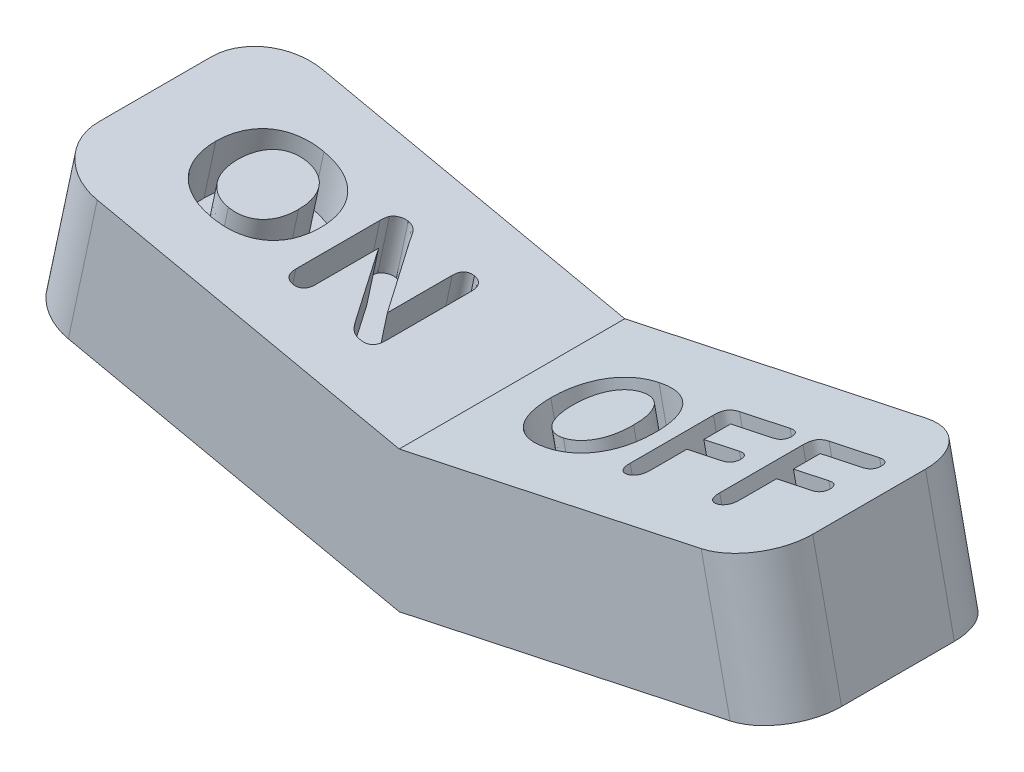
from build123d import *

# Parameters (mm, degrees)
AUFSATZ_LINEAR_AUSTRAGEN2_DEPTH = 4
SCHNITT_LINEAR_AUSTRAGEN1_DEPTH = 1
SCHNITT_LINEAR_AUSTRAGEN2_DEPTH = 1
VERRUNDUNG1_R                   = 1


with BuildPart() as part:
    # Skizze1 → Aufsatz-Linear austragen2 (new body)
    with BuildSketch(Plane.XY):
        Polygon((0.667578223, 3.856947524), (7, 2.5), (13.332421777, 3.856947524), (13.844616899, 1.466703621), (7, 0), (0.155383101, 1.466703621), align=None)
    extrude(amount=AUFSATZ_LINEAR_AUSTRAGEN2_DEPTH)

    # Skizze2 → Schnitt-Linear austragen1 (cut)
    # profile 1 of 2: a face of its own
    with BuildSketch(Plane(origin=(0.819512195, 3.824390244, 0), x_dir=(0.9778024140774095, -0.2095290887308736, 0), z_dir=(0.2095290887308736, 0.9778024140774095, 0))):
        with BuildLine():
            add(Edge.make_bspline(
                [(1.912976274, -1.025), (1.937729293, -1.025347484), (1.986265259, -1.026028833), (2.057705691, -1.03220508), (2.126606575, -1.04137252), (2.192921264, -1.054568029), (2.256485248, -1.071786253), (2.317310632, -1.09294775), (2.375475794, -1.117982427), (2.431048762, -1.146399113), (2.483419062, -1.178566708), (2.532920134, -1.213743636), (2.578991288, -1.252445964), (2.621739919, -1.294333963), (2.660893281, -1.339521926), (2.697020585, -1.387758951), (2.729843534, -1.43931638), (2.759008617, -1.494183256), (2.785211472, -1.55153976), (2.807957304, -1.611553994), (2.826941877, -1.673971707), (2.842732947, -1.73889629), (2.85470098, -1.806232722), (2.863131075, -1.876138703), (2.868967255, -1.948338503), (2.869398247, -1.997383913), (2.869616899, -2.022265625)],
                knots=[0, 0, 0, 0, 1.137132438, 2.22970057, 3.292424762, 4.329649132, 5.333981859, 6.315987487, 7.286185149, 8.241436353, 9.181332131, 10.107725602, 11.0292572, 11.943085262, 12.854854597, 13.773819033, 14.709898734, 15.660115542, 16.626635295, 17.605574315, 18.606712189, 19.622473761, 20.67399022, 21.747038223, 22.857027702, 24, 24, 24, 24], degree=3))
            add(Edge.make_bspline(
                [(2.869616899, -2.022265625), (2.868853842, -2.058751656), (2.867356635, -2.130341511), (2.85599984, -2.23514776), (2.836747841, -2.33491422), (2.810528051, -2.429600419), (2.776065586, -2.518550839), (2.734138271, -2.601648664), (2.684333621, -2.678492791), (2.627188206, -2.749013755), (2.562920535, -2.81281208), (2.491091537, -2.86842953), (2.412146644, -2.915899136), (2.326787109, -2.955883731), (2.234501668, -2.987386962), (2.135477181, -3.008566743), (2.030325273, -3.022981952), (1.957949638, -3.024315366), (1.920788774, -3.025)],
                knots=[0, 0, 0, 0, 1.119700056, 2.196982321, 3.230778928, 4.235358115, 5.208318876, 6.153781848, 7.087131445, 8.013361148, 8.934611457, 9.860297843, 10.794468433, 11.756326826, 12.748403726, 13.780058436, 14.860183413, 16, 16, 16, 16], degree=3))
            add(Edge.make_bspline(
                [(1.920788774, -3.025), (1.883895649, -3.024111768), (1.811670663, -3.022372892), (1.706383768, -3.008438854), (1.606832189, -2.986023965), (1.513584315, -2.95397486), (1.427291494, -2.91316174), (1.3475919, -2.865655446), (1.2760318, -2.809535138), (1.211692016, -2.746402733), (1.154577677, -2.676158659), (1.106021527, -2.598454758), (1.063198965, -2.514982226), (1.029350603, -2.424502932), (1.002420616, -2.328979796), (0.983440858, -2.229124849), (0.971868588, -2.125534077), (0.970375387, -2.055238614), (0.969616899, -2.01953125)],
                knots=[0, 0, 0, 0, 1.130091603, 2.212359386, 3.247930852, 4.252250901, 5.226719473, 6.16821431, 7.089197795, 8.00610207, 8.925165125, 9.855999165, 10.808795857, 11.79501972, 12.810514548, 13.846493258, 14.906102224, 16, 16, 16, 16], degree=3))
            add(Edge.make_bspline(
                [(0.969616899, -2.01953125), (0.970304926, -1.983167117), (0.971657834, -1.911662221), (0.984148642, -1.806900375), (1.003869909, -1.706602276), (1.031979339, -1.611272855), (1.06761968, -1.521581806), (1.110879562, -1.438507263), (1.160965417, -1.362306726), (1.21820868, -1.29312522), (1.282700256, -1.231383937), (1.354079344, -1.17738825), (1.431994591, -1.13094052), (1.516449577, -1.092736526), (1.607060062, -1.062072781), (1.703802482, -1.040423252), (1.806494954, -1.02730765), (1.876868571, -1.025782522), (1.912976274, -1.025)],
                knots=[0, 0, 0, 0, 1.125218611, 2.212582392, 3.260701818, 4.286054269, 5.284468473, 6.243521648, 7.180287843, 8.101949555, 9.017004541, 9.937572836, 10.866572707, 11.818894766, 12.801573564, 13.82236102, 14.882684417, 16, 16, 16, 16], degree=3))
        make_face()
        with BuildLine():
            add(Edge.make_bspline(
                [(2.469616899, -2.01953125), (2.468853014, -1.984722528), (2.467373957, -1.917324774), (2.454265409, -1.819828962), (2.433033611, -1.72939679), (2.407727956, -1.659374991), (2.383428267, -1.607471532), (2.363582759, -1.57134657), (2.342234834, -1.537336639), (2.31800541, -1.506574824), (2.292872072, -1.477593683), (2.265660747, -1.45107662), (2.236324033, -1.427418465), (2.19521348, -1.398703317), (2.139851328, -1.368949379), (2.068370022, -1.343453373), (1.99217361, -1.327741724), (1.939745088, -1.325926707), (1.912976274, -1.325)],
                knots=[0, 0, 0, 0, 1.663767962, 3.22144036, 4.693807908, 6.09809827, 6.772124886, 7.43249818, 8.068074837, 8.689496673, 9.30272399, 9.901527182, 10.503429657, 11.102750509, 12.297797107, 13.495176895, 14.721094103, 16, 16, 16, 16], degree=3))
            add(Edge.make_bspline(
                [(1.912976274, -1.325), (1.893801388, -1.325476979), (1.855904057, -1.326419684), (1.800272141, -1.335372453), (1.746832427, -1.349373624), (1.695833545, -1.368956527), (1.647729683, -1.393964897), (1.602736036, -1.424326737), (1.561395163, -1.459923848), (1.523475662, -1.500612084), (1.489204138, -1.546801438), (1.458798916, -1.598971034), (1.432306915, -1.657121574), (1.409721467, -1.720734194), (1.391858588, -1.789481786), (1.379157176, -1.862643567), (1.371178167, -1.939798117), (1.370145062, -1.992558261), (1.369616899, -2.01953125)],
                knots=[0, 0, 0, 0, 0.926902171, 1.831933723, 2.71800685, 3.595261319, 4.468550136, 5.334998465, 6.214894287, 7.1017058, 8.020008637, 8.99111482, 10.01694856, 11.106630737, 12.25237115, 13.448355624, 14.695502513, 16, 16, 16, 16], degree=3))
            add(Edge.make_bspline(
                [(1.369616899, -2.01953125), (1.37014652, -2.046764167), (1.371182677, -2.100043013), (1.3791454, -2.177980504), (1.391929725, -2.25203045), (1.409665044, -2.321886375), (1.432609519, -2.386733879), (1.460153093, -2.445978766), (1.49103067, -2.500043622), (1.527457171, -2.547420938), (1.566803876, -2.589229111), (1.609089968, -2.625643756), (1.654010316, -2.656665197), (1.701995078, -2.681919634), (1.752781192, -2.700868342), (1.805807248, -2.715229016), (1.861417487, -2.723431427), (1.899278599, -2.724472817), (1.918445024, -2.725)],
                knots=[0, 0, 0, 0, 1.300369924, 2.54406124, 3.737115199, 4.88637188, 5.981883645, 7.016846829, 8.003376514, 8.948590554, 9.863559023, 10.741055788, 11.608647785, 12.46534091, 13.323432129, 14.192248925, 15.0848625, 16, 16, 16, 16], degree=3))
            add(Edge.make_bspline(
                [(1.918445024, -2.725), (1.943130947, -2.724173196), (1.991770596, -2.722544111), (2.062991903, -2.707333439), (2.131038983, -2.683418186), (2.184917516, -2.65588187), (2.225524432, -2.628756898), (2.25486843, -2.605872755), (2.28214803, -2.579831695), (2.308150463, -2.551638957), (2.332245126, -2.520679799), (2.355057842, -2.48734684), (2.376120258, -2.45128373), (2.395606652, -2.412692096), (2.413204211, -2.371642144), (2.428553352, -2.32824289), (2.440789374, -2.282303546), (2.451468641, -2.234250749), (2.459592873, -2.183768426), (2.465370001, -2.131098381), (2.468989745, -2.076092443), (2.469404603, -2.038677613), (2.469616899, -2.01953125)],
                knots=[0, 0, 0, 0, 1.468568495, 2.893578421, 4.316075305, 5.755382189, 6.482330971, 7.222315454, 7.968369796, 8.725783183, 9.504530818, 10.302500265, 11.129737207, 11.9897977, 12.875655565, 13.787998707, 14.728608307, 15.705132475, 16.718642732, 17.771954593, 18.859838044, 20, 20, 20, 20], degree=3))
        make_face(mode=Mode.SUBTRACT)
    # profile 2 of 2: a face of its own
    with BuildSketch(Plane(origin=(0.819512195, 3.824390244, 0), x_dir=(0.9778024140774095, -0.2095290887308736, 0), z_dir=(0.2095290887308736, 0.9778024140774095, 0))):
        with BuildLine():
            Line((3.709460649, -1.259765625), (4.469616899, -2.4))
            Line((4.469616899, -2.4), (4.469616899, -1.24921875))
            add(Edge.make_bspline(
                [(4.469616899, -1.24921875), (4.470203734, -1.231604073), (4.471302903, -1.198610998), (4.479653301, -1.152351591), (4.494284966, -1.113110608), (4.51501909, -1.080885872), (4.540797884, -1.055681931), (4.571235921, -1.037776803), (4.60573453, -1.026803989), (4.630080749, -1.025614679), (4.642663774, -1.025)],
                knots=[0, 0, 0, 0, 1.319117216, 2.470765316, 3.505116792, 4.43580569, 5.318756254, 6.18027265, 7.059497782, 8, 8, 8, 8], degree=3))
            add(Edge.make_bspline(
                [(4.642663774, -1.025), (4.655629651, -1.025626222), (4.680726276, -1.02683833), (4.716217537, -1.037587787), (4.747237022, -1.055678759), (4.773423753, -1.080848886), (4.794535839, -1.113074728), (4.809681281, -1.152267739), (4.817897562, -1.19862235), (4.819018461, -1.231608024), (4.819616899, -1.24921875)],
                knots=[0, 0, 0, 0, 0.959871134, 1.857917088, 2.719075999, 3.600089629, 4.526699118, 5.554128738, 6.694173474, 8, 8, 8, 8], degree=3))
            Line((4.819616899, -1.24921875), (4.819616899, -2.7703125))
            add(Edge.make_bspline(
                [(4.819616899, -2.7703125), (4.819134348, -2.790278735), (4.818228655, -2.827753046), (4.808579527, -2.880151946), (4.792306955, -2.924753102), (4.769539154, -2.961759047), (4.739573417, -2.990792367), (4.702528328, -3.010748385), (4.659336383, -3.023212298), (4.628432719, -3.024384232), (4.612195024, -3.025)],
                knots=[0, 0, 0, 0, 1.276164049, 2.395212213, 3.391561633, 4.297456637, 5.151673506, 6.027862746, 6.963780962, 8, 8, 8, 8], degree=3))
            add(Edge.make_bspline(
                [(4.612195024, -3.025), (4.595732533, -3.024227584), (4.563980795, -3.022737801), (4.51823912, -3.011861052), (4.476649733, -2.991569313), (4.439280861, -2.962228716), (4.404297658, -2.926643533), (4.372276101, -2.88536809), (4.342107216, -2.840649843), (4.32145907, -2.810533705), (4.311023149, -2.7953125)],
                knots=[0, 0, 0, 0, 0.990229924, 1.909888509, 2.806876858, 3.75171819, 4.754420985, 5.802993103, 6.889595585, 8, 8, 8, 8], degree=3))
            Line((4.311023149, -2.7953125), (3.569616899, -1.675))
            Line((3.569616899, -1.675), (3.569616899, -2.801953125))
            add(Edge.make_bspline(
                [(3.569616899, -2.801953125), (3.569031422, -2.819175517), (3.567922379, -2.851799112), (3.559358995, -2.897673499), (3.543605465, -2.9368426), (3.521961286, -2.9690538), (3.4953822, -2.994116261), (3.464996564, -3.012159467), (3.430899134, -3.023163326), (3.406939103, -3.024376227), (3.394616899, -3.025)],
                knots=[0, 0, 0, 0, 1.293064309, 2.449392962, 3.484384031, 4.441729672, 5.340986808, 6.204611779, 7.076664708, 8, 8, 8, 8], degree=3))
            add(Edge.make_bspline(
                [(3.394616899, -3.025), (3.382032855, -3.024399573), (3.357520746, -3.023230019), (3.322823517, -3.011926015), (3.292306883, -2.993270805), (3.265657072, -2.968066855), (3.244920992, -2.935248079), (3.230110125, -2.896077142), (3.221214497, -2.850522755), (3.220170306, -2.818011694), (3.219616899, -2.80078125)],
                knots=[0, 0, 0, 0, 0.938889884, 1.828837584, 2.693878765, 3.596100726, 4.546832571, 5.570326044, 6.712304089, 8, 8, 8, 8], degree=3))
            Line((3.219616899, -2.80078125), (3.219616899, -1.30859375))
            add(Edge.make_bspline(
                [(3.219616899, -1.30859375), (3.219763449, -1.293605547), (3.220040562, -1.265264266), (3.224139298, -1.225357793), (3.229740217, -1.19023628), (3.236683215, -1.169207133), (3.239929399, -1.159375)],
                knots=[0, 0, 0, 0, 1.18793306, 2.246269525, 3.180047019, 4, 4, 4, 4], degree=3))
            add(Edge.make_bspline(
                [(3.239929399, -1.159375), (3.244285353, -1.149807915), (3.252981773, -1.130707761), (3.272050985, -1.105399317), (3.293815733, -1.08181179), (3.320081963, -1.062379236), (3.348422531, -1.045863512), (3.37847924, -1.033656999), (3.409892824, -1.026329272), (3.431167398, -1.025445247), (3.441882524, -1.025)],
                knots=[0, 0, 0, 0, 0.980600708, 1.957714689, 2.948627098, 3.97434472, 5.000279326, 6.011426356, 6.998437519, 8, 8, 8, 8], degree=3))
            add(Edge.make_bspline(
                [(3.441882524, -1.025), (3.457894035, -1.025637009), (3.487918544, -1.026831517), (3.529318626, -1.040659117), (3.564562342, -1.060929143), (3.595039553, -1.088596973), (3.623856551, -1.122790804), (3.650564641, -1.164946481), (3.679486383, -1.211258084), (3.699316822, -1.243349807), (3.709460649, -1.259765625)],
                knots=[0, 0, 0, 0, 1.01695463, 1.906975685, 2.751376853, 3.592506721, 4.517315556, 5.594915983, 6.76973195, 8, 8, 8, 8], degree=3))
        make_face()
    extrude(amount=-SCHNITT_LINEAR_AUSTRAGEN1_DEPTH, mode=Mode.SUBTRACT)

    # Skizze3 → Schnitt-Linear austragen2 (cut)
    # profile 1 of 3: a face of its own
    with BuildSketch(Plane(origin=(-0.204878049, 0.956097561, 0), x_dir=(0.9778024140774095, 0.20952908873087336, 0), z_dir=(-0.20952908873087336, 0.9778024140774096, 0))):
        with BuildLine():
            add(Edge.make_bspline(
                [(9.036798995, -1.025), (9.061552015, -1.025347484), (9.110087981, -1.026028833), (9.181528413, -1.03220508), (9.250429297, -1.04137252), (9.316743986, -1.054568029), (9.38030797, -1.071786253), (9.441133353, -1.09294775), (9.499298516, -1.117982427), (9.554871484, -1.146399113), (9.607241784, -1.178566708), (9.656742856, -1.213743636), (9.70281401, -1.252445964), (9.74556264, -1.294333963), (9.784716003, -1.339521926), (9.820843306, -1.387758951), (9.853666256, -1.43931638), (9.882831339, -1.494183256), (9.909034194, -1.55153976), (9.931780026, -1.611553994), (9.950764599, -1.673971707), (9.966555669, -1.73889629), (9.978523702, -1.806232722), (9.986953797, -1.876138703), (9.992789977, -1.948338503), (9.993220969, -1.997383913), (9.99343962, -2.022265625)],
                knots=[0, 0, 0, 0, 1.137132438, 2.22970057, 3.292424762, 4.329649132, 5.333981859, 6.315987487, 7.286185149, 8.241436353, 9.181332131, 10.107725602, 11.0292572, 11.943085262, 12.854854597, 13.773819033, 14.709898734, 15.660115542, 16.626635295, 17.605574315, 18.606712189, 19.622473761, 20.67399022, 21.747038223, 22.857027702, 24, 24, 24, 24], degree=3))
            add(Edge.make_bspline(
                [(9.99343962, -2.022265625), (9.992676564, -2.058751656), (9.991179357, -2.130341511), (9.979822561, -2.23514776), (9.960570563, -2.33491422), (9.934350773, -2.429600419), (9.899888308, -2.518550839), (9.857960993, -2.601648664), (9.808156342, -2.678492791), (9.751010928, -2.749013755), (9.686743256, -2.81281208), (9.614914259, -2.86842953), (9.535969366, -2.915899136), (9.45060983, -2.955883731), (9.35832439, -2.987386962), (9.259299902, -3.008566743), (9.154147994, -3.022981952), (9.08177236, -3.024315366), (9.044611495, -3.025)],
                knots=[0, 0, 0, 0, 1.119700056, 2.196982321, 3.230778928, 4.235358115, 5.208318876, 6.153781848, 7.087131445, 8.013361148, 8.934611457, 9.860297843, 10.794468433, 11.756326826, 12.748403726, 13.780058436, 14.860183413, 16, 16, 16, 16], degree=3))
            add(Edge.make_bspline(
                [(9.044611495, -3.025), (9.007718371, -3.024111768), (8.935493385, -3.022372892), (8.830206489, -3.008438854), (8.730654911, -2.986023965), (8.637407036, -2.95397486), (8.551114215, -2.91316174), (8.471414621, -2.865655446), (8.399854521, -2.809535138), (8.335514738, -2.746402733), (8.278400399, -2.676158659), (8.229844249, -2.598454758), (8.187021687, -2.514982226), (8.153173325, -2.424502932), (8.126243337, -2.328979796), (8.10726358, -2.229124849), (8.09569131, -2.125534077), (8.094198108, -2.055238614), (8.09343962, -2.01953125)],
                knots=[0, 0, 0, 0, 1.130091603, 2.212359386, 3.247930852, 4.252250901, 5.226719473, 6.16821431, 7.089197795, 8.00610207, 8.925165125, 9.855999165, 10.808795857, 11.79501972, 12.810514548, 13.846493258, 14.906102224, 16, 16, 16, 16], degree=3))
            add(Edge.make_bspline(
                [(8.09343962, -2.01953125), (8.094127648, -1.983167117), (8.095480556, -1.911662221), (8.107971364, -1.806900375), (8.127692631, -1.706602276), (8.155802061, -1.611272855), (8.191442402, -1.521581806), (8.234702284, -1.438507263), (8.284788138, -1.362306726), (8.342031402, -1.29312522), (8.406522977, -1.231383937), (8.477902066, -1.17738825), (8.555817313, -1.13094052), (8.640272299, -1.092736526), (8.730882784, -1.062072781), (8.827625204, -1.040423252), (8.930317675, -1.02730765), (9.000691293, -1.025782522), (9.036798995, -1.025)],
                knots=[0, 0, 0, 0, 1.125218611, 2.212582392, 3.260701818, 4.286054269, 5.284468473, 6.243521648, 7.180287843, 8.101949555, 9.017004541, 9.937572836, 10.866572707, 11.818894766, 12.801573564, 13.82236102, 14.882684417, 16, 16, 16, 16], degree=3))
        make_face()
        with BuildLine():
            add(Edge.make_bspline(
                [(9.59343962, -2.01953125), (9.592675736, -1.984722528), (9.591196678, -1.917324774), (9.578088131, -1.819828962), (9.556856333, -1.72939679), (9.531550678, -1.659374991), (9.507250989, -1.607471532), (9.487405481, -1.57134657), (9.466057555, -1.537336639), (9.441828132, -1.506574824), (9.416694794, -1.477593683), (9.389483469, -1.45107662), (9.360146755, -1.427418465), (9.319036202, -1.398703317), (9.26367405, -1.368949379), (9.192192743, -1.343453373), (9.115996331, -1.327741724), (9.06356781, -1.325926707), (9.036798995, -1.325)],
                knots=[0, 0, 0, 0, 1.663767962, 3.22144036, 4.693807908, 6.09809827, 6.772124886, 7.43249818, 8.068074837, 8.689496673, 9.30272399, 9.901527182, 10.503429657, 11.102750509, 12.297797107, 13.495176895, 14.721094103, 16, 16, 16, 16], degree=3))
            add(Edge.make_bspline(
                [(9.036798995, -1.325), (9.01762411, -1.325476979), (8.979726778, -1.326419684), (8.924094863, -1.335372453), (8.870655149, -1.349373624), (8.819656267, -1.368956527), (8.771552404, -1.393964897), (8.726558758, -1.424326737), (8.685217885, -1.459923848), (8.647298384, -1.500612084), (8.61302686, -1.546801438), (8.582621638, -1.598971034), (8.556129636, -1.657121574), (8.533544189, -1.720734194), (8.515681309, -1.789481786), (8.502979897, -1.862643567), (8.495000889, -1.939798117), (8.493967783, -1.992558261), (8.49343962, -2.01953125)],
                knots=[0, 0, 0, 0, 0.926902171, 1.831933723, 2.71800685, 3.595261319, 4.468550136, 5.334998465, 6.214894287, 7.1017058, 8.020008637, 8.99111482, 10.01694856, 11.106630737, 12.25237115, 13.448355624, 14.695502513, 16, 16, 16, 16], degree=3))
            add(Edge.make_bspline(
                [(8.49343962, -2.01953125), (8.493969241, -2.046764167), (8.495005399, -2.100043013), (8.502968122, -2.177980504), (8.515752447, -2.25203045), (8.533487766, -2.321886375), (8.556432241, -2.386733879), (8.583975815, -2.445978766), (8.614853392, -2.500043622), (8.651279893, -2.547420938), (8.690626598, -2.589229111), (8.73291269, -2.625643756), (8.777833038, -2.656665197), (8.8258178, -2.681919634), (8.876603914, -2.700868342), (8.929629969, -2.715229016), (8.985240209, -2.723431427), (9.023101321, -2.724472817), (9.042267745, -2.725)],
                knots=[0, 0, 0, 0, 1.300369924, 2.54406124, 3.737115199, 4.88637188, 5.981883645, 7.016846829, 8.003376514, 8.948590554, 9.863559023, 10.741055788, 11.608647785, 12.46534091, 13.323432129, 14.192248925, 15.0848625, 16, 16, 16, 16], degree=3))
            add(Edge.make_bspline(
                [(9.042267745, -2.725), (9.066953669, -2.724173196), (9.115593318, -2.722544111), (9.186814625, -2.707333439), (9.254861704, -2.683418186), (9.308740238, -2.65588187), (9.349347154, -2.628756898), (9.378691152, -2.605872755), (9.405970752, -2.579831695), (9.431973185, -2.551638957), (9.456067848, -2.520679799), (9.478880564, -2.48734684), (9.499942979, -2.45128373), (9.519429374, -2.412692096), (9.537026932, -2.371642144), (9.552376074, -2.32824289), (9.564612096, -2.282303546), (9.575291363, -2.234250749), (9.583415595, -2.183768426), (9.589192723, -2.131098381), (9.592812467, -2.076092443), (9.593227324, -2.038677613), (9.59343962, -2.01953125)],
                knots=[0, 0, 0, 0, 1.468568495, 2.893578421, 4.316075305, 5.755382189, 6.482330971, 7.222315454, 7.968369796, 8.725783183, 9.504530818, 10.302500265, 11.129737207, 11.9897977, 12.875655565, 13.787998707, 14.728608307, 15.705132475, 16.718642732, 17.771954593, 18.859838044, 20, 20, 20, 20], degree=3))
        make_face(mode=Mode.SUBTRACT)
    # profile 2 of 3: a face of its own
    with BuildSketch(Plane(origin=(-0.204878049, 0.956097561, 0), x_dir=(0.9778024140774095, 0.20952908873087336, 0), z_dir=(-0.20952908873087336, 0.9778024140774096, 0))):
        with BuildLine():
            Line((11.464923995, -1.375), (10.69343962, -1.375))
            Line((10.69343962, -1.375), (10.69343962, -1.85))
            Line((10.69343962, -1.85), (11.338361495, -1.85))
            add(Edge.make_bspline(
                [(11.338361495, -1.85), (11.352322892, -1.85054121), (11.378643196, -1.851561509), (11.415550441, -1.858610856), (11.44684486, -1.871628659), (11.472475523, -1.889756682), (11.491902733, -1.912738826), (11.506296599, -1.938819437), (11.514729373, -1.968765353), (11.515626699, -1.989788952), (11.51609587, -2.00078125)],
                knots=[0, 0, 0, 0, 1.26669481, 2.387998457, 3.388485007, 4.319542635, 5.207485584, 6.095585677, 7.004267047, 8, 8, 8, 8], degree=3))
            add(Edge.make_bspline(
                [(11.51609587, -2.00078125), (11.515664656, -2.011658342), (11.514833774, -2.032616786), (11.50575904, -2.062251015), (11.491688722, -2.088549775), (11.471620519, -2.110889705), (11.44606836, -2.128855746), (11.414734006, -2.141086888), (11.37834706, -2.149115945), (11.352212779, -2.149693757), (11.338361495, -2.15)],
                knots=[0, 0, 0, 0, 0.989228558, 1.906087716, 2.798941975, 3.690531566, 4.619691956, 5.620966574, 6.739101907, 8, 8, 8, 8], degree=3))
            Line((11.338361495, -2.15), (10.69343962, -2.15))
            Line((10.69343962, -2.15), (10.69343962, -2.786328125))
            add(Edge.make_bspline(
                [(10.69343962, -2.786328125), (10.692946643, -2.805256065), (10.692017597, -2.840926898), (10.68244281, -2.890618881), (10.666258509, -2.932897009), (10.642661209, -2.966760138), (10.614313131, -2.993063893), (10.581539307, -3.011321615), (10.545442077, -3.023374494), (10.519841158, -3.024449214), (10.50672087, -3.025)],
                knots=[0, 0, 0, 0, 1.324745361, 2.496561692, 3.52818871, 4.472071426, 5.363073267, 6.212819431, 7.084082786, 8, 8, 8, 8], degree=3))
            add(Edge.make_bspline(
                [(10.50672087, -3.025), (10.493338058, -3.024462647), (10.467347968, -3.02341908), (10.430762109, -3.011308245), (10.397612224, -2.993192692), (10.369263478, -2.966733411), (10.345492346, -2.932994055), (10.330253943, -2.890817356), (10.319601429, -2.84206705), (10.318843338, -2.806971322), (10.31843962, -2.78828125)],
                knots=[0, 0, 0, 0, 0.935462148, 1.816714299, 2.675664794, 3.567975675, 4.513245122, 5.543029804, 6.691551627, 8, 8, 8, 8], degree=3))
            Line((10.31843962, -2.78828125), (10.31843962, -1.312890625))
            add(Edge.make_bspline(
                [(10.31843962, -1.312890625), (10.31874359, -1.299597168), (10.319323468, -1.274237409), (10.323559842, -1.237980686), (10.330714585, -1.205520777), (10.341343735, -1.176826464), (10.355200957, -1.151746265), (10.372237225, -1.129865671), (10.39368803, -1.112619482), (10.417763321, -1.098170549), (10.445667748, -1.087935466), (10.476635949, -1.079932914), (10.511306925, -1.075947878), (10.535489333, -1.07532534), (10.54812712, -1.075)],
                knots=[0, 0, 0, 0, 1.248307341, 2.381380143, 3.422634109, 4.362988604, 5.244318775, 6.105654139, 6.948029729, 7.814212849, 8.731706968, 9.728269157, 10.812787817, 12, 12, 12, 12], degree=3))
            Line((10.54812712, -1.075), (11.464923995, -1.075))
            add(Edge.make_bspline(
                [(11.464923995, -1.075), (11.479531854, -1.07554078), (11.506878754, -1.076553157), (11.545295231, -1.083515813), (11.577485053, -1.096994379), (11.604072668, -1.115094278), (11.624069235, -1.137868554), (11.639259569, -1.163545901), (11.647893273, -1.192951293), (11.648822408, -1.213618031), (11.649298995, -1.22421875)],
                knots=[0, 0, 0, 0, 1.306215152, 2.44532304, 3.467849054, 4.404266228, 5.294549162, 6.155037916, 7.053652051, 8, 8, 8, 8], degree=3))
            add(Edge.make_bspline(
                [(11.649298995, -1.22421875), (11.648841022, -1.235085447), (11.647953306, -1.25614898), (11.639142581, -1.286100281), (11.624327866, -1.312418859), (11.604031432, -1.335251546), (11.57758211, -1.353485499), (11.545187342, -1.366357117), (11.506896723, -1.37348854), (11.479538111, -1.374473738), (11.464923995, -1.375)],
                knots=[0, 0, 0, 0, 0.963504472, 1.867615256, 2.742849562, 3.627587234, 4.558171791, 5.569908026, 6.701920807, 8, 8, 8, 8], degree=3))
        make_face()
    # profile 3 of 3: a face of its own
    with BuildSketch(Plane(origin=(-0.204878049, 0.956097561, 0), x_dir=(0.9778024140774095, 0.20952908873087336, 0), z_dir=(-0.20952908873087336, 0.9778024140774096, 0))):
        with BuildLine():
            Line((13.089923995, -1.375), (12.31843962, -1.375))
            Line((12.31843962, -1.375), (12.31843962, -1.85))
            Line((12.31843962, -1.85), (12.963361495, -1.85))
            add(Edge.make_bspline(
                [(12.963361495, -1.85), (12.977322892, -1.85054121), (13.003643196, -1.851561509), (13.040550441, -1.858610856), (13.07184486, -1.871628659), (13.097475523, -1.889756682), (13.116902733, -1.912738826), (13.131296599, -1.938819437), (13.139729373, -1.968765353), (13.140626699, -1.989788952), (13.14109587, -2.00078125)],
                knots=[0, 0, 0, 0, 1.26669481, 2.387998457, 3.388485007, 4.319542635, 5.207485584, 6.095585677, 7.004267047, 8, 8, 8, 8], degree=3))
            add(Edge.make_bspline(
                [(13.14109587, -2.00078125), (13.140664656, -2.011658342), (13.139833774, -2.032616786), (13.13075904, -2.062251015), (13.116688722, -2.088549775), (13.096620519, -2.110889705), (13.07106836, -2.128855746), (13.039734006, -2.141086888), (13.00334706, -2.149115945), (12.977212779, -2.149693757), (12.963361495, -2.15)],
                knots=[0, 0, 0, 0, 0.989228558, 1.906087716, 2.798941975, 3.690531566, 4.619691956, 5.620966574, 6.739101907, 8, 8, 8, 8], degree=3))
            Line((12.963361495, -2.15), (12.31843962, -2.15))
            Line((12.31843962, -2.15), (12.31843962, -2.786328125))
            add(Edge.make_bspline(
                [(12.31843962, -2.786328125), (12.317946643, -2.805256065), (12.317017597, -2.840926898), (12.30744281, -2.890618881), (12.291258509, -2.932897009), (12.267661209, -2.966760138), (12.239313131, -2.993063893), (12.206539307, -3.011321615), (12.170442077, -3.023374494), (12.144841158, -3.024449214), (12.13172087, -3.025)],
                knots=[0, 0, 0, 0, 1.324745361, 2.496561692, 3.52818871, 4.472071426, 5.363073267, 6.212819431, 7.084082786, 8, 8, 8, 8], degree=3))
            add(Edge.make_bspline(
                [(12.13172087, -3.025), (12.118338058, -3.024462647), (12.092347968, -3.02341908), (12.055762109, -3.011308245), (12.022612224, -2.993192692), (11.994263478, -2.966733411), (11.970492346, -2.932994055), (11.955253943, -2.890817356), (11.944601429, -2.84206705), (11.943843338, -2.806971322), (11.94343962, -2.78828125)],
                knots=[0, 0, 0, 0, 0.935462148, 1.816714299, 2.675664794, 3.567975675, 4.513245122, 5.543029804, 6.691551627, 8, 8, 8, 8], degree=3))
            Line((11.94343962, -2.78828125), (11.94343962, -1.312890625))
            add(Edge.make_bspline(
                [(11.94343962, -1.312890625), (11.94374359, -1.299597168), (11.944323468, -1.274237409), (11.948559842, -1.237980686), (11.955714585, -1.205520777), (11.966343735, -1.176826464), (11.980200957, -1.151746265), (11.997237225, -1.129865671), (12.01868803, -1.112619482), (12.042763321, -1.098170549), (12.070667748, -1.087935466), (12.101635949, -1.079932914), (12.136306925, -1.075947878), (12.160489333, -1.07532534), (12.17312712, -1.075)],
                knots=[0, 0, 0, 0, 1.248307341, 2.381380143, 3.422634109, 4.362988604, 5.244318775, 6.105654139, 6.948029729, 7.814212849, 8.731706968, 9.728269157, 10.812787817, 12, 12, 12, 12], degree=3))
            Line((12.17312712, -1.075), (13.089923995, -1.075))
            add(Edge.make_bspline(
                [(13.089923995, -1.075), (13.104531854, -1.07554078), (13.131878754, -1.076553157), (13.170295231, -1.083515813), (13.202485053, -1.096994379), (13.229072668, -1.115094278), (13.249069235, -1.137868554), (13.264259569, -1.163545901), (13.272893273, -1.192951293), (13.273822408, -1.213618031), (13.274298995, -1.22421875)],
                knots=[0, 0, 0, 0, 1.306215152, 2.44532304, 3.467849054, 4.404266228, 5.294549162, 6.155037916, 7.053652051, 8, 8, 8, 8], degree=3))
            add(Edge.make_bspline(
                [(13.274298995, -1.22421875), (13.273841022, -1.235085447), (13.272953306, -1.25614898), (13.264142581, -1.286100281), (13.249327866, -1.312418859), (13.229031432, -1.335251546), (13.20258211, -1.353485499), (13.170187342, -1.366357117), (13.131896723, -1.37348854), (13.104538111, -1.374473738), (13.089923995, -1.375)],
                knots=[0, 0, 0, 0, 0.963504472, 1.867615256, 2.742849562, 3.627587234, 4.558171791, 5.569908026, 6.701920807, 8, 8, 8, 8], degree=3))
        make_face()
    extrude(amount=-SCHNITT_LINEAR_AUSTRAGEN2_DEPTH, mode=Mode.SUBTRACT)

    # Verrundung1
    verrundung1_edges = [part.edges().sort_by_distance(p)[0] for p in [
        (13.588519338, 2.661825572, 4),
        (0.411480662, 2.661825572, 4),
        (13.588519338, 2.661825572, 0),
        (0.411480662, 2.661825572, 0),
    ]]
    fillet(verrundung1_edges, radius=VERRUNDUNG1_R)


solid = part.part
